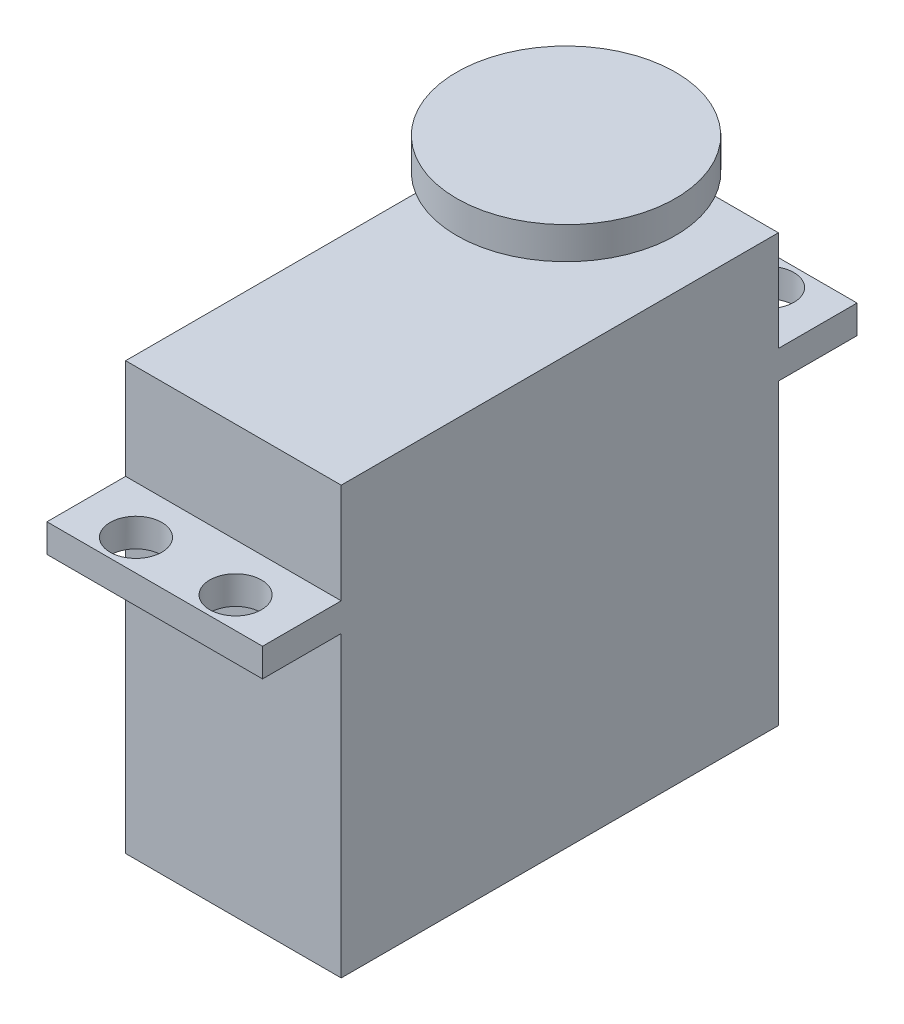
from build123d import *

# Parameters (mm, degrees)
SKETCH1_W           = 19.8
SKETCH1_H           = 40.15
BOSS_EXTRUDE1_DEPTH = 39.2
SKETCH4_W           = 19.8
SKETCH4_H           = 2.6
BOSS_EXTRUDE2_DEPTH = 7.225
CUT_EXTRUDE1_REACH  = 43.753
SKETCH5_R           = 2.375
SKETCH6_R           = 2.825
BOSS_EXTRUDE3_DEPTH = 4.65
SKETCH8_R           = 10.05
BOSS_EXTRUDE4_DEPTH = 2.95


with BuildPart() as part:
    # Sketch1 → Boss-Extrude1 (new body)
    with BuildSketch(Plane(origin=(0, 0, 0), x_dir=(1, 0, 0), z_dir=(0, 1, 0))):
        Rectangle(SKETCH1_W, SKETCH1_H)
    extrude(amount=BOSS_EXTRUDE1_DEPTH)

    # Sketch4 → Boss-Extrude2 (add)
    with BuildSketch(Plane(origin=(0, 0, -20.075), x_dir=(-1, 0, 0), z_dir=(0, 0, -1))):
        with Locations((0, 28.7)):
            Rectangle(SKETCH4_W, SKETCH4_H)
    boss_extrude2 = extrude(amount=BOSS_EXTRUDE2_DEPTH)

    # Sketch5 → Cut-Extrude1 (cut, up to next)
    with BuildSketch(Plane(origin=(0, 30, 0), x_dir=(1, 0, 0), z_dir=(0, 1, 0)), mode=Mode.PRIVATE) as cut_extrude1_sk1:
        with Locations(Location((4.575, 24.45, 0), (0, 0, 270))):
            Circle(SKETCH5_R)
    cut_extrude1_tool1 = extrude(cut_extrude1_sk1.sketch, amount=-CUT_EXTRUDE1_REACH, mode=Mode.PRIVATE) & part.part
    # Sketch5 → Cut-Extrude1 (cut, up to next)
    with BuildSketch(Plane(origin=(0, 30, 0), x_dir=(1, 0, 0), z_dir=(0, 1, 0)), mode=Mode.PRIVATE) as cut_extrude1_sk2:
        with Locations(Location((-4.575, 24.45, 0), (0, 0, 270))):
            Circle(SKETCH5_R)
    cut_extrude1_tool2 = extrude(cut_extrude1_sk2.sketch, amount=-CUT_EXTRUDE1_REACH, mode=Mode.PRIVATE) & part.part
    cut_extrude1_1 = cut_extrude1_tool1.solids().sort_by_distance((4.575, 30, -24.45))[0]
    add(cut_extrude1_1, mode=Mode.SUBTRACT)
    cut_extrude1_2 = cut_extrude1_tool2.solids().sort_by_distance((-4.575, 30, -24.45))[0]
    add(cut_extrude1_2, mode=Mode.SUBTRACT)
    cut_extrude1 = cut_extrude1_1 + cut_extrude1_2  # Cut-Extrude1 as one shape, for the pattern or mirror that repeats it

    # Mirror2: Boss-Extrude2, Cut-Extrude1 across plane
    add(boss_extrude2.mirror(Plane.XY))
    add(cut_extrude1.mirror(Plane.XY), mode=Mode.SUBTRACT)

    # Sketch6 → Boss-Extrude3 (add)
    with BuildSketch(Plane(origin=(0, 39.2, 0), x_dir=(1, 0, 0), z_dir=(0, 1, 0))):
        with Locations(Location((0, 10.475, 0), (0, 0, 270))):
            Circle(SKETCH6_R)
    extrude(amount=BOSS_EXTRUDE3_DEPTH)

    # Sketch8 → Boss-Extrude4 (add)
    with BuildSketch(Plane(origin=(0, 43.85, 0), x_dir=(1, 0, 0), z_dir=(0, 1, 0))):
        with Locations(Location((0, 10.475, 0), (0, 0, 270))):
            Circle(SKETCH8_R)
    extrude(amount=BOSS_EXTRUDE4_DEPTH)


solid = part.part
